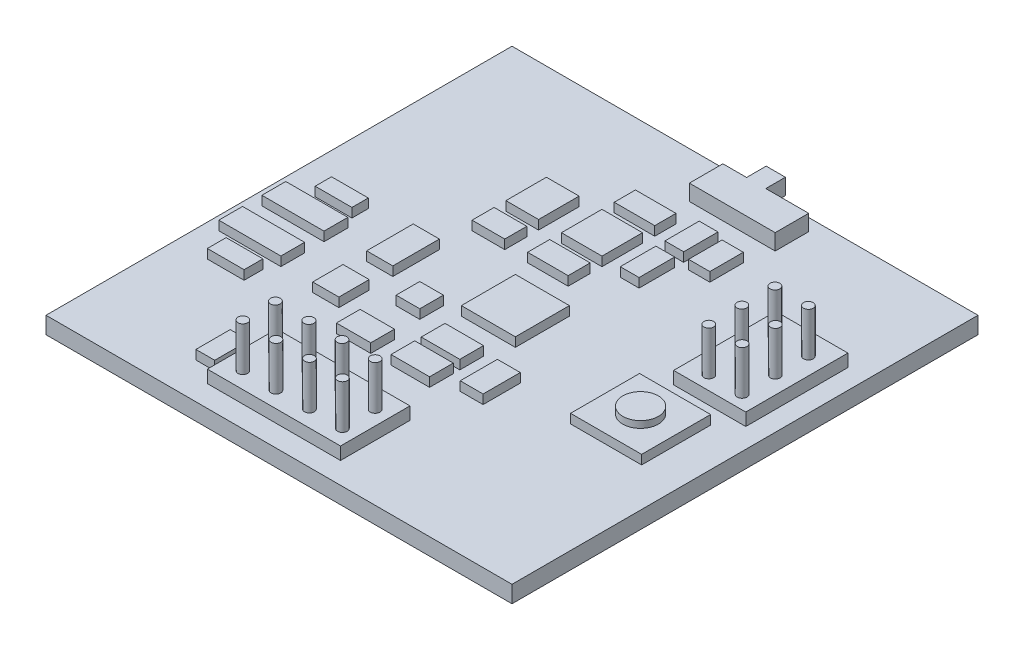
from build123d import *

# Parameters (mm, degrees)
SKETCH1_W           = 35.052
SKETCH1_H           = 35.052
BOSS_EXTRUDE1_DEPTH = 1.27
SKETCH2_W           = 6.452921714
SKETCH2_H           = 2.519712288
SKETCH2_W_2         = 1.444225336
SKETCH2_H_2         = 1.474953535
BOSS_EXTRUDE2_DEPTH = 1.19888
SKETCH2_3_W         = 3.048
SKETCH2_3_H         = 1.597866329
BOSS_EXTRUDE3_DEPTH = 0.69088
SKETCH2_4_W         = 1.778
SKETCH2_4_H         = 1.778
SKETCH2_4_W_2       = 4.064
SKETCH2_4_H_2       = 4.064
SKETCH2_4_W_3       = 3.048
SKETCH2_4_H_3       = 3.048
SKETCH2_4_W_4       = 2.458255891
SKETCH2_4_W_5       = 1.597866329
SKETCH2_4_H_4       = 2.519712288
SKETCH2_4_W_6       = 1.413497138
SKETCH2_4_H_5       = 2.581168686
SKETCH2_4_H_6       = 2.679261616
SKETCH2_4_H_7       = 1.659322727
SKETCH2_4_W_7       = 1.966604713
SKETCH2_4_H_8       = 3.503014645
SKETCH2_4_H_9       = 2.27812222
SKETCH2_4_W_8       = 2.581168686
SKETCH2_4_H_10      = 1.782235521
SKETCH2_4_W_9       = 2.900860604
SKETCH2_4_H_11      = 1.786471042
SKETCH2_4_W_10      = 1.720779123
SKETCH2_4_H_12      = 2.796266077
SKETCH2_4_W_11      = 4.670686193
SKETCH2_4_H_13      = 1.79654074
SKETCH2_4_W_12      = 2.765537878
SKETCH2_4_H_14      = 1.229127945
SKETCH2_4_H_15      = 1.413497137
BOSS_EXTRUDE4_DEPTH = 0.69088
SKETCH2_5_R         = 0.368738384
SKETCH2_5_R_2       = 0.372973905
SKETCH2_5_R_3       = 0.365334134
BOSS_EXTRUDE5_DEPTH = 4.24688
SKETCH2_6_W         = 5.424501995
SKETCH2_6_H         = 7.68204966
SKETCH2_6_R         = 0.365334134
SKETCH2_6_W_2       = 10.017392757
SKETCH2_6_H_2       = 5.223793769
SKETCH2_6_R_2       = 0.368738384
SKETCH2_6_R_3       = 0.372973905
BOSS_EXTRUDE6_DEPTH = 0.94488
SKETCH2_7_R         = 1.337651576
BOSS_EXTRUDE7_DEPTH = 1.19888
SKETCH2_8_W         = 5.346706563
SKETCH2_8_H         = 5.19094781
SKETCH2_8_R         = 1.337651576
BOSS_EXTRUDE8_DEPTH = 0.69088


with BuildPart() as part:
    # Sketch1 → Boss-Extrude1 (new body)
    with BuildSketch(Plane(origin=(0, 0, 0), x_dir=(1, 0, 0), z_dir=(0, 1, 0))):
        with Locations((17.526, 17.526)):
            Rectangle(SKETCH1_W, SKETCH1_H)
    extrude(amount=BOSS_EXTRUDE1_DEPTH)

    # Sketch2<3> → Boss-Extrude3 (add)
    with BuildSketch(Plane(origin=(0, 1.27, 0), x_dir=(1, 0, 0), z_dir=(0, 1, 0))):
        with Locations((16.223005725, 28.840795859)):
            Rectangle(SKETCH2_3_W, SKETCH2_3_H)
    extrude(amount=BOSS_EXTRUDE3_DEPTH)

    # Sketch2<4> → Boss-Extrude4 (add)
    with BuildSketch(Plane(origin=(0, 1.27, 0), x_dir=(1, 0, 0), z_dir=(0, 1, 0))):
        with Locations((13.43703182, 14.677214046)):
            Rectangle(SKETCH2_4_W, SKETCH2_4_H)
        with Locations((17.714308082, 17.590336267)):
            Rectangle(SKETCH2_4_W_2, SKETCH2_4_H_2)
        with Locations((16.223005725, 25.596016735)):
            Rectangle(SKETCH2_4_W_3, SKETCH2_4_H_3)
        with Locations((11.749098656, 25.596016735)):
            Rectangle(SKETCH2_4_W_4, SKETCH2_4_H_3)
        with Locations((22.012317002, 28.379872879)):
            Rectangle(SKETCH2_4_W_5, SKETCH2_4_H_4)
        with Locations((19.830614898, 28.717883064)):
            Rectangle(SKETCH2_4_W_6, SKETCH2_4_H_5)
        with Locations((19.830614898, 25.411647543)):
            Rectangle(SKETCH2_4_W_6, SKETCH2_4_H_6)
        with Locations((11.749098656, 22.357145946)):
            Rectangle(SKETCH2_4_W_4, SKETCH2_4_H_7)
        with Locations((16.223005725, 22.357145946)):
            Rectangle(SKETCH2_4_W_3, SKETCH2_4_H_7)
        with Locations((9.536668354, 17.317721369)):
            Rectangle(SKETCH2_4_W_7, SKETCH2_4_H_8)
        with Locations((9.536668354, 12.649152936)):
            Rectangle(SKETCH2_4_W_7, SKETCH2_4_H_9)
        with Locations((13.408421382, 10.618974066)):
            Rectangle(SKETCH2_4_W_8, SKETCH2_4_H_10)
        with Locations((17.673436027, 12.894978525)):
            Rectangle(SKETCH2_4_W_9, SKETCH2_4_H_11)
        with Locations((17.673436027, 10.618974066)):
            Rectangle(SKETCH2_4_W_9, SKETCH2_4_H_10)
        with Locations((21.397753029, 12.017107104)):
            Rectangle(SKETCH2_4_W_10, SKETCH2_4_H_12)
        with Locations((3.329572229, 16.142897211)):
            Rectangle(SKETCH2_4_W_11, SKETCH2_4_H_13)
        with Locations((3.329572229, 12.894978525)):
            Rectangle(SKETCH2_4_W_11, SKETCH2_4_H_11)
        with Locations((3.790495208, 18.454664719)):
            Rectangle(SKETCH2_4_W_12, SKETCH2_4_H_14)
        with Locations((3.790495208, 10.434604874)):
            Rectangle(SKETCH2_4_W_12, SKETCH2_4_H_15)
        with Locations((9.260114566, 4.012411358)):
            Rectangle(SKETCH2_4_W_6, SKETCH2_4_H_5)
    extrude(amount=BOSS_EXTRUDE4_DEPTH)

    # Sketch2<5> → Boss-Extrude5 (add)
    with BuildSketch(Plane(origin=(0, 1.27, 0), x_dir=(1, 0, 0), z_dir=(0, 1, 0))):
        with Locations((11.952697536, 5.302995701)):
            Circle(SKETCH2_5_R)
        with Locations((14.471900881, 5.302995701)):
            Circle(SKETCH2_5_R_2)
        with Locations((16.963420672, 5.302995701)):
            Circle(SKETCH2_5_R_3)
        with Locations((19.454940464, 5.302995701)):
            Circle(SKETCH2_5_R_3)
        with Locations((19.468782241, 2.825153872)):
            Circle(SKETCH2_5_R_3)
        with Locations((16.963420672, 2.852837425)):
            Circle(SKETCH2_5_R_3)
        with Locations((14.471900881, 2.825153872)):
            Circle(SKETCH2_5_R_3)
        with Locations((11.952697536, 2.852837425)):
            Circle(SKETCH2_5_R_3)
        with Locations((29.758781713, 25.069345596)):
            Circle(SKETCH2_5_R_3)
        with Locations((32.276984447, 25.069345596)):
            Circle(SKETCH2_5_R_3)
        with Locations((32.276984447, 22.58449654)):
            Circle(SKETCH2_5_R_3)
        with Locations((32.276984447, 20.082970645)):
            Circle(SKETCH2_5_R_3)
        with Locations((29.758781713, 20.099647484)):
            Circle(SKETCH2_5_R_3)
        with Locations((29.758781713, 22.58449654)):
            Circle(SKETCH2_5_R_3)
    extrude(amount=BOSS_EXTRUDE5_DEPTH)

    # Sketch2<6> → Boss-Extrude6 (add)
    # profile 1 of 2: a face of its own
    with BuildSketch(Plane(origin=(0, 1.27, 0), x_dir=(1, 0, 0), z_dir=(0, 1, 0))):
        with Locations((30.853868693, 22.910253521)):
            Rectangle(SKETCH2_6_W, SKETCH2_6_H)
        with Locations((29.758781713, 20.099647484)):
            Circle(SKETCH2_6_R, mode=Mode.SUBTRACT)
        with Locations((32.276984447, 20.082970645)):
            Circle(SKETCH2_6_R, mode=Mode.SUBTRACT)
        with Locations((29.758781713, 22.58449654)):
            Circle(SKETCH2_6_R, mode=Mode.SUBTRACT)
        with Locations((32.276984447, 22.58449654)):
            Circle(SKETCH2_6_R, mode=Mode.SUBTRACT)
        with Locations((29.758781713, 25.069345596)):
            Circle(SKETCH2_6_R, mode=Mode.SUBTRACT)
        with Locations((32.276984447, 25.069345596)):
            Circle(SKETCH2_6_R, mode=Mode.SUBTRACT)
    # profile 2 of 2: a face of its own
    with BuildSketch(Plane(origin=(0, 1.27, 0), x_dir=(1, 0, 0), z_dir=(0, 1, 0))):
        with Locations((15.528667089, 4.227508749)):
            Rectangle(SKETCH2_6_W_2, SKETCH2_6_H_2)
        with Locations((11.952697536, 2.852837425)):
            Circle(SKETCH2_6_R, mode=Mode.SUBTRACT)
        with Locations((11.952697536, 5.302995701)):
            Circle(SKETCH2_6_R_2, mode=Mode.SUBTRACT)
        with Locations((14.471900881, 2.825153872)):
            Circle(SKETCH2_6_R, mode=Mode.SUBTRACT)
        with Locations((16.963420672, 2.852837425)):
            Circle(SKETCH2_6_R, mode=Mode.SUBTRACT)
        with Locations((14.471900881, 5.302995701)):
            Circle(SKETCH2_6_R_3, mode=Mode.SUBTRACT)
        with Locations((16.963420672, 5.302995701)):
            Circle(SKETCH2_6_R, mode=Mode.SUBTRACT)
        with Locations((19.468782241, 2.825153872)):
            Circle(SKETCH2_6_R, mode=Mode.SUBTRACT)
        with Locations((19.454940464, 5.302995701)):
            Circle(SKETCH2_6_R, mode=Mode.SUBTRACT)
    extrude(amount=BOSS_EXTRUDE6_DEPTH)

    # Sketch2<7> → Boss-Extrude7 (add)
    with BuildSketch(Plane(origin=(0, 1.27, 0), x_dir=(1, 0, 0), z_dir=(0, 1, 0))):
        with Locations((29.479269271, 15.244626841)):
            Circle(SKETCH2_7_R)
    extrude(amount=BOSS_EXTRUDE7_DEPTH)

    # Sketch2<8> → Boss-Extrude8 (add)
    with BuildSketch(Plane(origin=(0, 1.27, 0), x_dir=(1, 0, 0), z_dir=(0, 1, 0))):
        with Locations((29.479269271, 15.244626841)):
            Rectangle(SKETCH2_8_W, SKETCH2_8_H)
        with Locations((29.479269271, 15.244626841)):
            Circle(SKETCH2_8_R, mode=Mode.SUBTRACT)
    extrude(amount=BOSS_EXTRUDE8_DEPTH)


with BuildPart() as body_2:
    # Sketch2 → Boss-Extrude2 (new body)
    with BuildSketch(Plane(origin=(0, 1.27, 0), x_dir=(1, 0, 0), z_dir=(0, 1, 0))):
        with Locations((20.01498409, 32.86618988)):
            Rectangle(SKETCH2_W, SKETCH2_H)
        with Locations((19.292871422, 34.863522792)):
            Rectangle(SKETCH2_W_2, SKETCH2_H_2)
    extrude(amount=BOSS_EXTRUDE2_DEPTH)


solid = Compound([part.part, body_2.part])
